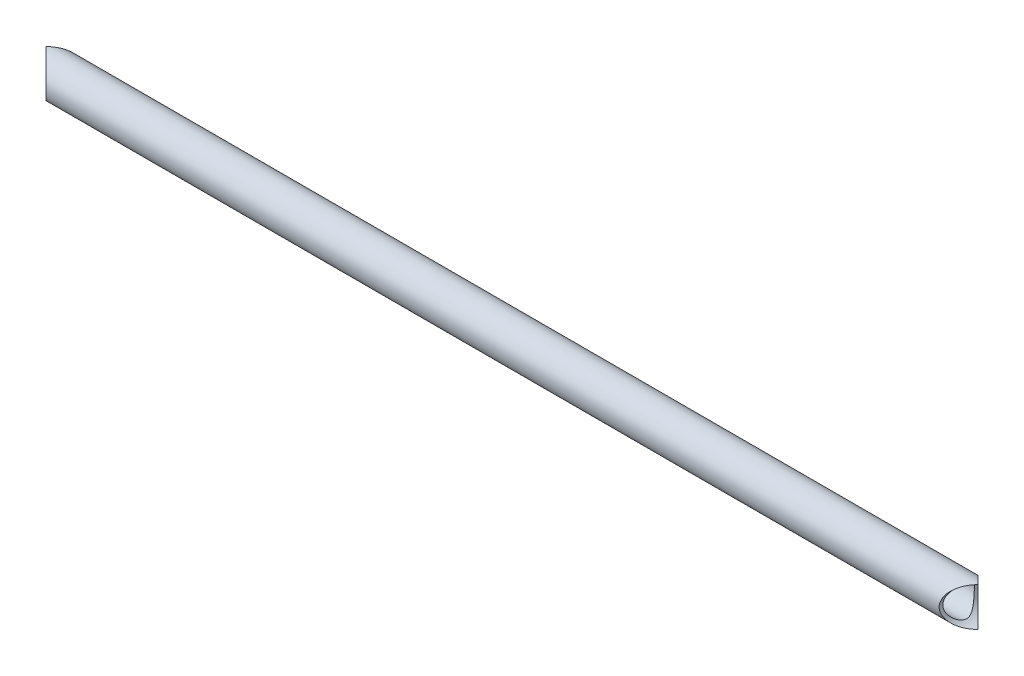
from build123d import *

# Parameters (mm, degrees)
SKETCH1_R                          = 7.9375
SKETCH1_R_2                        = 6.4375
PIPE_CONFIGURED_21_3_X_2_3_5_DEPTH = 380.814777714
CORTE_EXTRUS_O1_DEPTH              = 907.343202597
CORTE_EXTRUS_O1_DEPTH_BACK         = 907.343202597
ESBO_O17_R                         = 7.9375


with BuildPart() as part:
    # Sketch1 → Pipe - configured 21.3 X 2.3(5) (new body)
    with BuildSketch(Plane(origin=(854.389836714, 250, -150), x_dir=(0, 0, 1), z_dir=(-1, 0, 0))):
        Circle(SKETCH1_R)
        Circle(SKETCH1_R_2, mode=Mode.SUBTRACT)
    extrude(amount=PIPE_CONFIGURED_21_3_X_2_3_5_DEPTH)

    # Esboço17 → Corte-extrusão1 (cut, two sides: drawn at the far end of the back side and taken through both)
    with BuildSketch(Plane.XY.offset(-CORTE_EXTRUS_O1_DEPTH_BACK)):
        with Locations((473.575059, 250)):
            Circle(ESBO_O17_R)
        with Locations((854.389836714, 250)):
            Circle(ESBO_O17_R)
    extrude(amount=CORTE_EXTRUS_O1_DEPTH + CORTE_EXTRUS_O1_DEPTH_BACK, mode=Mode.SUBTRACT)


solid = part.part
